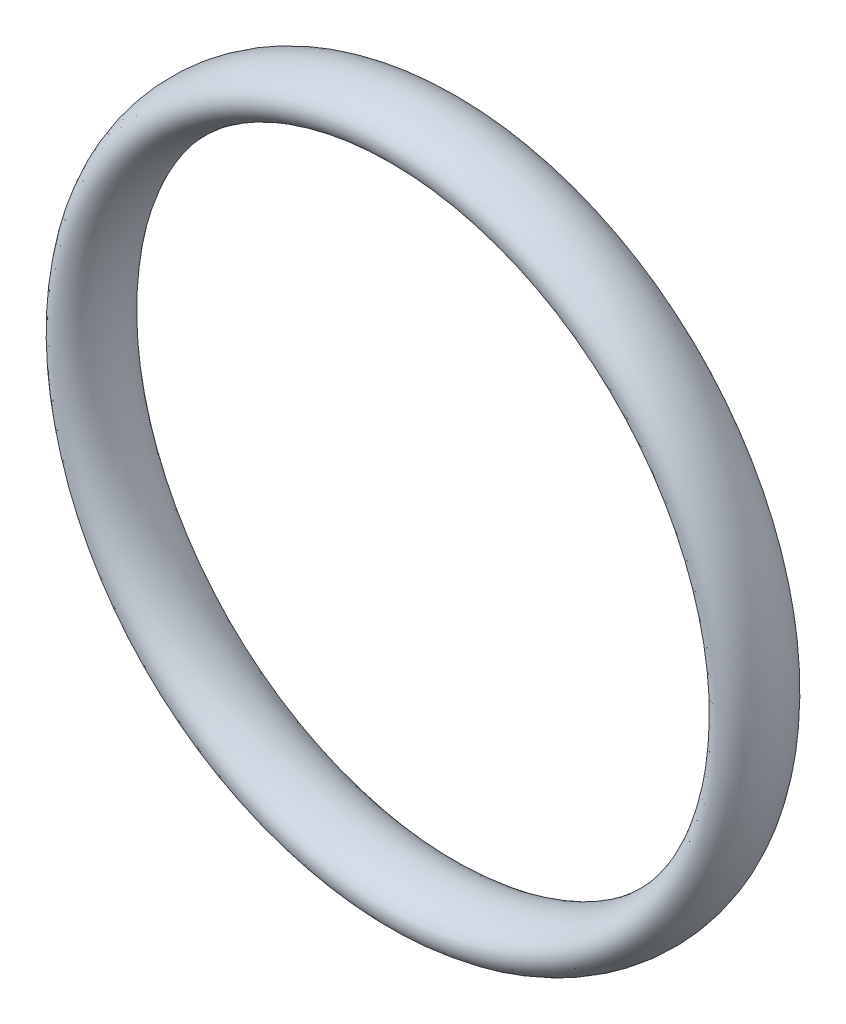
from build123d import *

# Parameters (mm, degrees)
SKETCH1_RX = 2
SKETCH1_RY = 1.25


with BuildPart() as part:
    # Sketch1 → Revolve1 (revolve)
    with BuildSketch(Plane(origin=(0, 0, 0), x_dir=(0, 0, -1), z_dir=(1, 0, 0))):
        with Locations(Location((0, 17.25), (0, 0, 180))):
            Ellipse(SKETCH1_RX, SKETCH1_RY)
    revolve(axis=Axis((0, 0, 0), (0, 0, 1)))


solid = part.part
